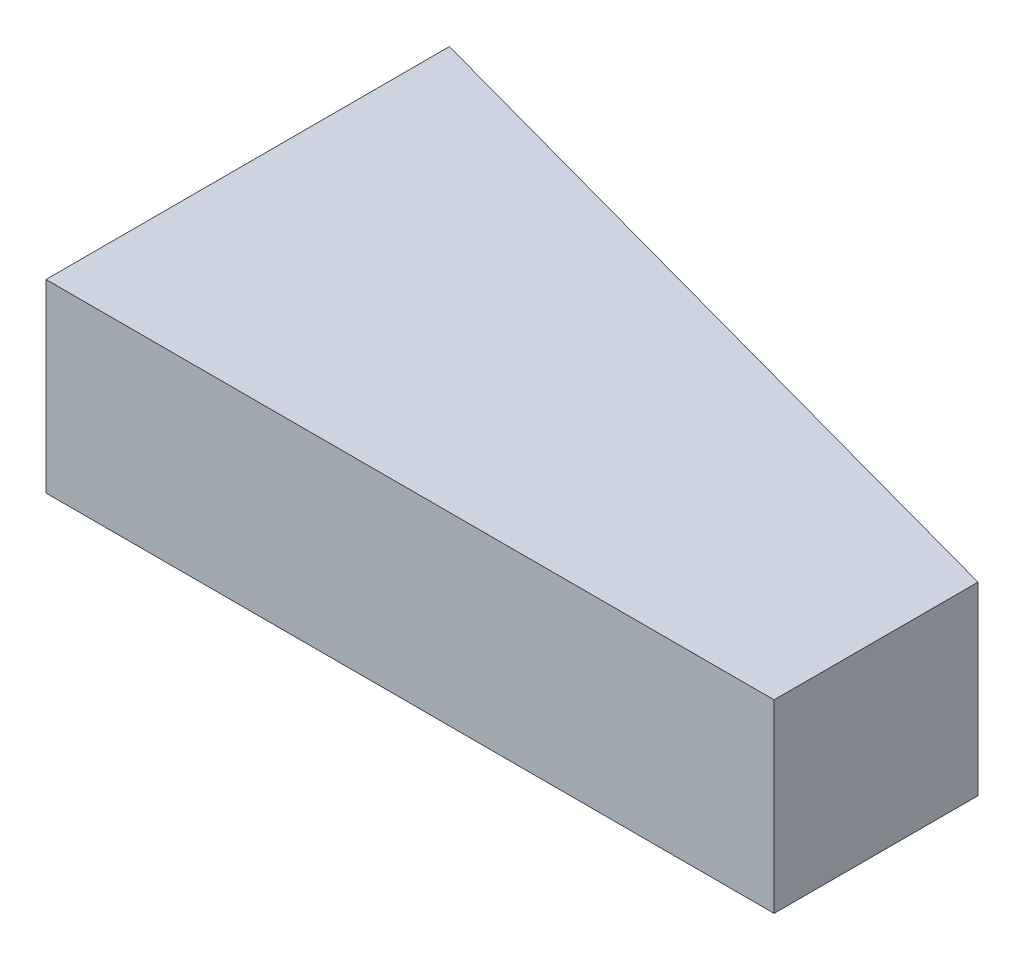
from build123d import *

# Parameters (mm, degrees)
BOSS_EXTRUDE1_DEPTH = 25.4


with BuildPart() as part:
    # Sketch2 → Boss-Extrude1 (new body)
    with BuildSketch(Plane(origin=(0, 0, 0), x_dir=(1, 0, 0), z_dir=(0, 1, 0))):
        Polygon((0, 0), (0, 55.4), (100, 28), (100, 0), align=None)
    extrude(amount=BOSS_EXTRUDE1_DEPTH)


solid = part.part
